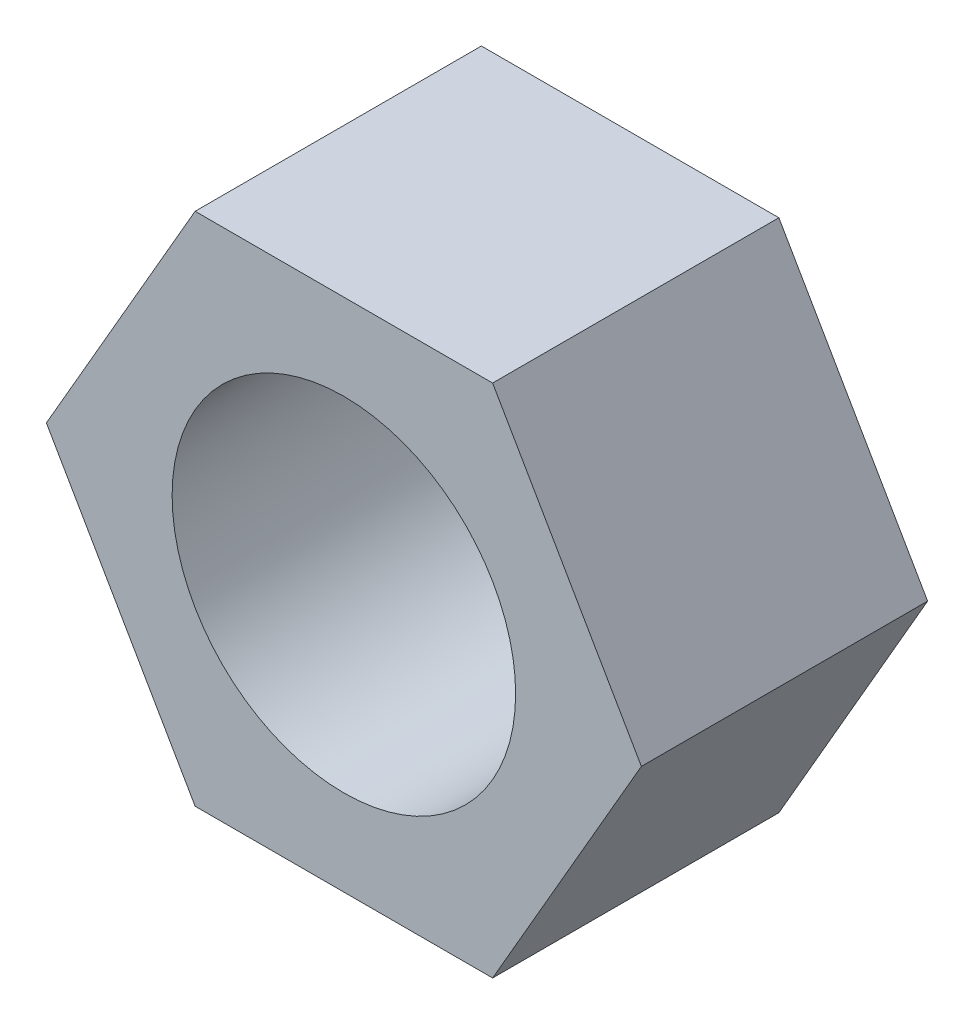
from build123d import *

# Parameters (mm, degrees)
SKETCH1_R           = 15
BOSS_EXTRUDE1_DEPTH = 25


with BuildPart() as part:
    # Sketch1 → Boss-Extrude1 (new body)
    with BuildSketch(Plane.XY):
        Polygon((25.980762114, 0), (12.990381057, 22.5), (-12.990381057, 22.5), (-25.980762114, 0), (-12.990381057, -22.5), (12.990381057, -22.5), align=None)
        Circle(SKETCH1_R, mode=Mode.SUBTRACT)
    extrude(amount=BOSS_EXTRUDE1_DEPTH)


solid = part.part
